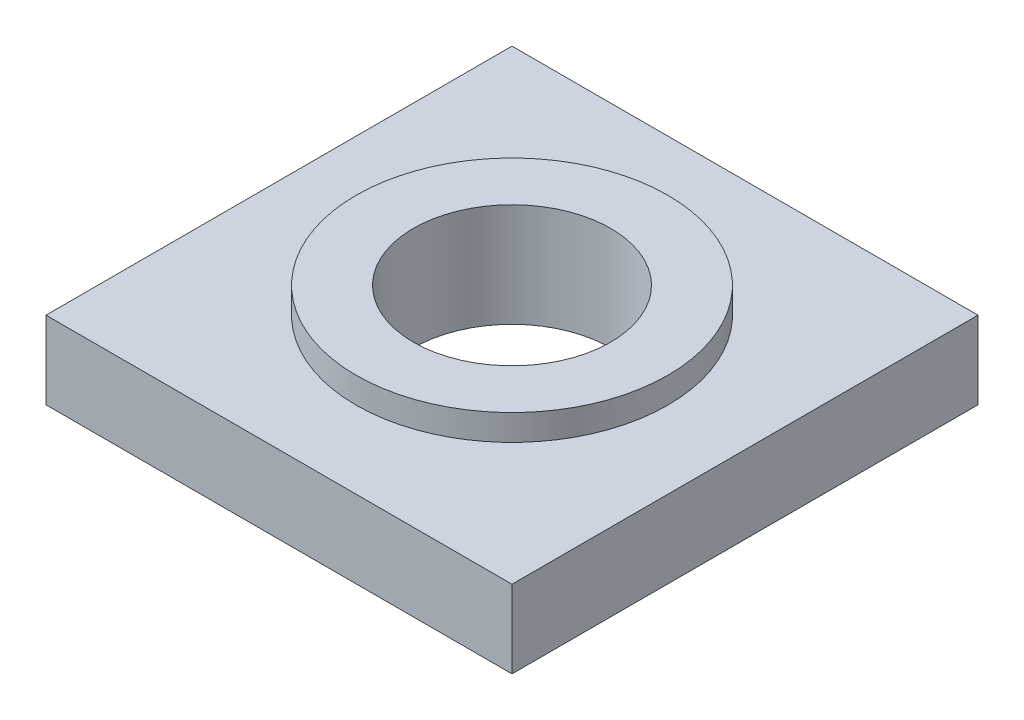
from build123d import *

# Parameters (mm, degrees)
SKETCH1_W           = 90
SKETCH1_H           = 90
SKETCH1_R           = 19.05
BOSS_EXTRUDE1_DEPTH = 15
SKETCH2_R           = 30.106358648
SKETCH2_R_2         = 19.05
BOSS_EXTRUDE3_DEPTH = 5


with BuildPart() as part:
    # Sketch1 → Boss-Extrude1 (new body)
    with BuildSketch(Plane(origin=(0, 0, 0), x_dir=(1, 0, 0), z_dir=(0, 1, 0))):
        Rectangle(SKETCH1_W, SKETCH1_H)
        with Locations(Location((0, 0, 0), (0, 0, 270))):
            Circle(SKETCH1_R, mode=Mode.SUBTRACT)
    extrude(amount=BOSS_EXTRUDE1_DEPTH)

    # Sketch2 → Boss-Extrude3 (add)
    with BuildSketch(Plane(origin=(0, 15, 0), x_dir=(1, 0, 0), z_dir=(0, 1, 0))):
        with Locations(Location((0, 0, 0), (0, 0, 270))):
            Circle(SKETCH2_R)
        with Locations(Location((0, 0, 0), (0, 0, 270))):
            Circle(SKETCH2_R_2, mode=Mode.SUBTRACT)
    extrude(amount=BOSS_EXTRUDE3_DEPTH)


solid = part.part
